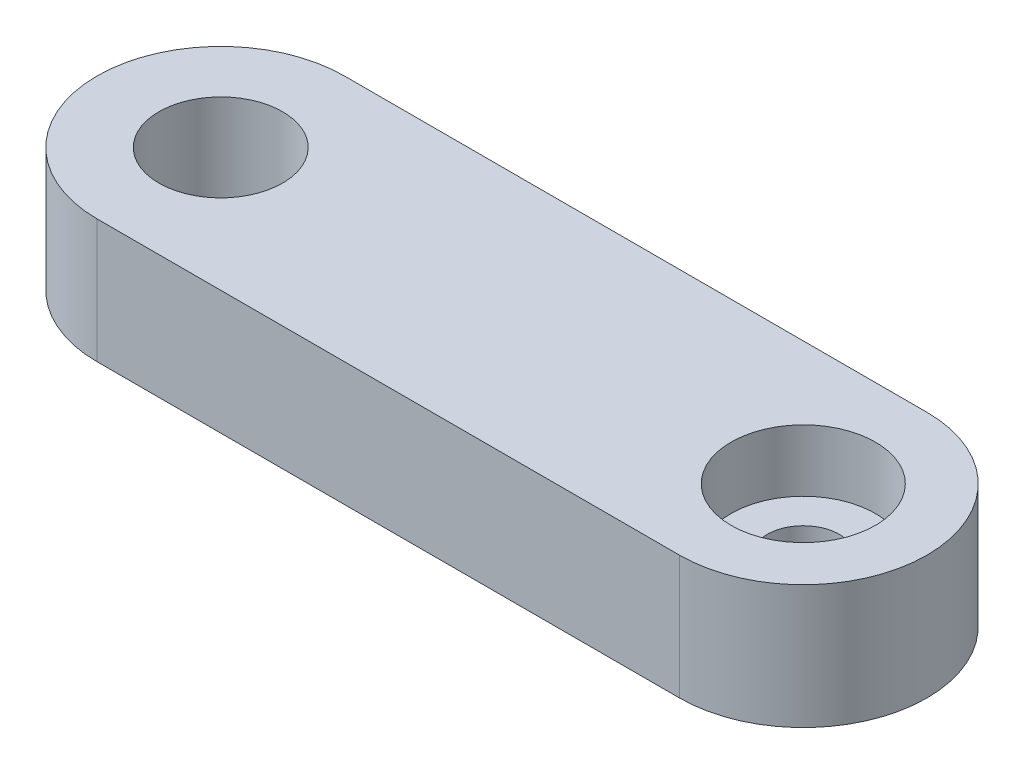
from build123d import *

# Parameters (mm, degrees)
SKETCH1_R           = 1.75
SKETCH1_R_2         = 3
BOSS_EXTRUDE1_DEPTH = 6
SKETCH2_R           = 3.5
CUT_EXTRUDE1_DEPTH  = 3


with BuildPart() as part:
    # Sketch1 → Boss-Extrude1 (new body)
    with BuildSketch(Plane(origin=(0, 0, 0), x_dir=(1, 0, 0), z_dir=(0, 1, 0))):
        with BuildLine():
            Line((0, -6), (-28.25, -6))
            ThreePointArc((-28.25, -6), (-34.25, 0), (-28.25, 6))
            Line((-28.25, 6), (0, 6))
            ThreePointArc((0, 6), (6, 0), (0, -6))
        make_face()
        with Locations(Location((0, 0, 0), (0, 0, 270))):
            Circle(SKETCH1_R, mode=Mode.SUBTRACT)
        with Locations(Location((-28.25, 0, 0), (0, 0, 270))):
            Circle(SKETCH1_R_2, mode=Mode.SUBTRACT)
    extrude(amount=BOSS_EXTRUDE1_DEPTH)

    # Sketch2 → Cut-Extrude1 (cut)
    with BuildSketch(Plane(origin=(0, 6, 0), x_dir=(1, 0, 0), z_dir=(0, 1, 0))):
        with Locations(Location((0, 0, 0), (0, 0, 270))):
            Circle(SKETCH2_R)
    extrude(amount=-CUT_EXTRUDE1_DEPTH, mode=Mode.SUBTRACT)


solid = part.part
